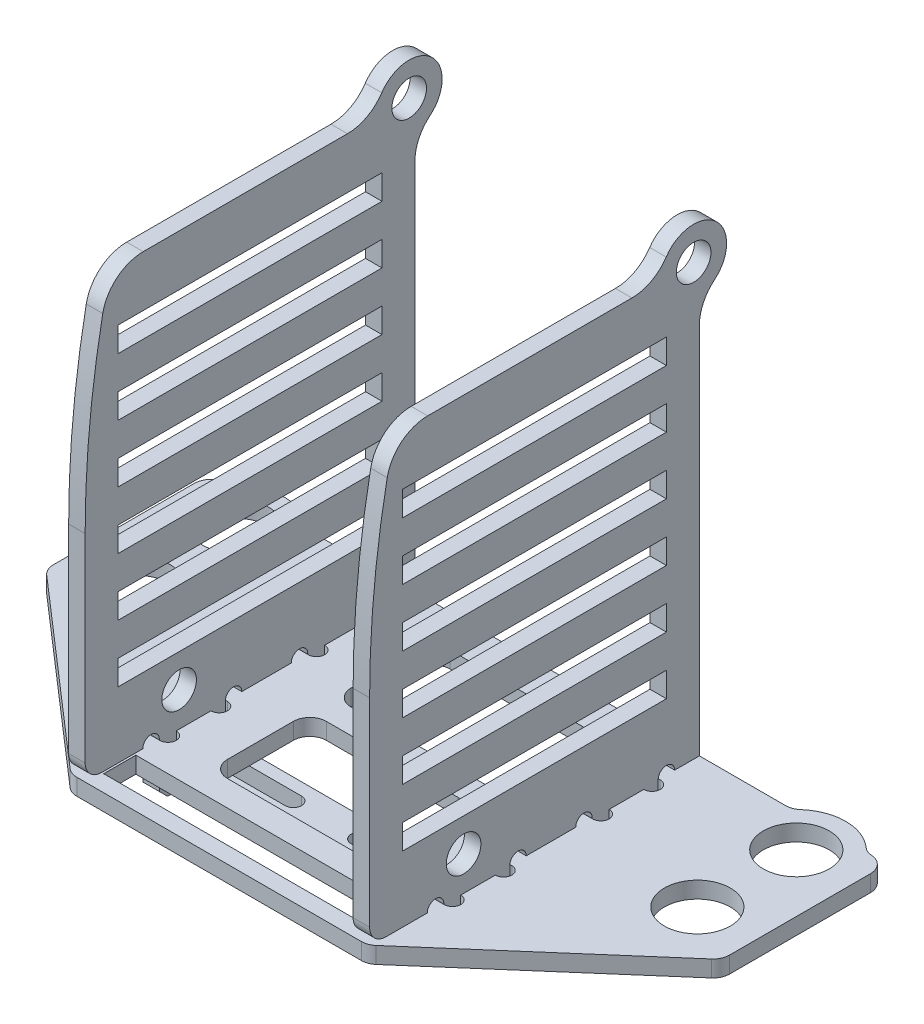
from build123d import *

# Parameters (mm, degrees)
SKETCH_1_R      = 4
SKETCH_1_W      = 20
SKETCH_1_H      = 12
SKETCH_1_W_2    = 32
SKETCH_1_H_2    = 3.9
EXTRUDE_1_DEPTH = 2
FILLET_1_R      = 2
FILLET_2_R      = 2
SKETCH_2_R      = 2.1
SKETCH_2_W      = 32
SKETCH_2_H      = 3
EXTRUDE_2_DEPTH = 1
FILLET_3_R      = 5
FILLET_4_R      = 2
CHAMFER_1_SIZE  = 1
EXTRUDE_3_DEPTH = 1


with BuildPart() as part:
    # 草图1 → 凸台-拉伸1 (new body)
    with BuildSketch(Plane(origin=(0, 0, 0), x_dir=(1, 0, 0), z_dir=(0, 1, 0))):
        with BuildLine():
            Line((-41, -10), (-41, 10))
            Line((-41, 10), (-38.472135955, 10))
            ThreePointArc((-38.472135955, 10), (-34, 12), (-29.527864045, 10))
            Line((-29.527864045, 10), (29.527864045, 10))
            ThreePointArc((29.527864045, 10), (34, 12), (38.472135955, 10))
            Line((38.472135955, 10), (41, 10))
            Line((41, 10), (41, -10))
            Line((41, -10), (18, -30))
            Line((18, -30), (-18, -30))
            Line((-18, -30), (-41, -10))
        make_face()
        with Locations(Location((-34, 6, 0), (0, 0, 270))):
            Circle(SKETCH_1_R, mode=Mode.SUBTRACT)
        with Locations(Location((-34, -6, 0), (0, 0, 90))):
            Circle(SKETCH_1_R, mode=Mode.SUBTRACT)
        with Locations(Location((34, -6, 0), (0, 0, 270))):
            Circle(SKETCH_1_R, mode=Mode.SUBTRACT)
        with Locations(Location((34, 6, 0), (0, 0, 90))):
            Circle(SKETCH_1_R, mode=Mode.SUBTRACT)
        with BuildLine():
            Line((-18.4, -12.9), (-16.1, -12.9))
            ThreePointArc((-16.1, -12.9), (-15.1, -13.9), (-16.1, -14.9))
            Line((-16.1, -14.9), (-16.1, -19.1))
            ThreePointArc((-16.1, -19.1), (-15.1, -20.1), (-16.1, -21.1))
            Line((-16.1, -21.1), (-18.4, -21.1))
            ThreePointArc((-18.4, -21.1), (-19.4, -20.1), (-18.4, -19.1))
            Line((-18.4, -19.1), (-18.4, -14.9))
            ThreePointArc((-18.4, -14.9), (-19.4, -13.9), (-18.4, -12.9))
        make_face(mode=Mode.SUBTRACT)
        with BuildLine():
            Line((-18.4, 5.1), (-16.1, 5.1))
            ThreePointArc((-16.1, 5.1), (-15.1, 4.1), (-16.1, 3.1))
            Line((-16.1, 3.1), (-16.1, -1.1))
            ThreePointArc((-16.1, -1.1), (-15.1, -2.1), (-16.1, -3.1))
            Line((-16.1, -3.1), (-18.4, -3.1))
            ThreePointArc((-18.4, -3.1), (-19.4, -2.1), (-18.4, -1.1))
            Line((-18.4, -1.1), (-18.4, 3.1))
            ThreePointArc((-18.4, 3.1), (-19.4, 4.1), (-18.4, 5.1))
        make_face(mode=Mode.SUBTRACT)
        with BuildLine():
            Line((18.4, -14.9), (18.4, -19.1))
            ThreePointArc((18.4, -19.1), (19.4, -20.1), (18.4, -21.1))
            Line((18.4, -21.1), (16.1, -21.1))
            ThreePointArc((16.1, -21.1), (15.1, -20.1), (16.1, -19.1))
            Line((16.1, -19.1), (16.1, -14.9))
            ThreePointArc((16.1, -14.9), (15.1, -13.9), (16.1, -12.9))
            Line((16.1, -12.9), (18.4, -12.9))
            ThreePointArc((18.4, -12.9), (19.4, -13.9), (18.4, -14.9))
        make_face(mode=Mode.SUBTRACT)
        with BuildLine():
            Line((18.4, 3.1), (18.4, -1.1))
            ThreePointArc((18.4, -1.1), (19.4, -2.1), (18.4, -3.1))
            Line((18.4, -3.1), (16.1, -3.1))
            ThreePointArc((16.1, -3.1), (15.1, -2.1), (16.1, -1.1))
            Line((16.1, -1.1), (16.1, 3.1))
            ThreePointArc((16.1, 3.1), (15.1, 4.1), (16.1, 5.1))
            Line((16.1, 5.1), (18.4, 5.1))
            ThreePointArc((18.4, 5.1), (19.4, 4.1), (18.4, 3.1))
        make_face(mode=Mode.SUBTRACT)
        with Locations((0, -15)):
            Rectangle(SKETCH_1_W, SKETCH_1_H, mode=Mode.SUBTRACT)
        with Locations((0, -26.05)):
            Rectangle(SKETCH_1_W_2, SKETCH_1_H_2, mode=Mode.SUBTRACT)
        Rectangle(SKETCH_1_W, SKETCH_1_H, mode=Mode.SUBTRACT)
    extrude(amount=EXTRUDE_1_DEPTH)

    # 圆角1
    fillet_1_edges = [part.edges().sort_by_distance(p)[0] for p in [
        (10, 1, 6),
        (10, 1, -6),
        (-10, 1, -6),
        (-10, 1, 6),
        (-41, 1, 10),
        (-10, 1, 21),
        (-41, 1, -10),
        (10, 1, 21),
        (10, 1, 9),
        (-10, 1, 9),
        (41, 1, -10),
        (41, 1, 10),
        (18, 1, 30),
        (-18, 1, 30),
    ]]
    fillet(fillet_1_edges, radius=FILLET_1_R)

    # 圆角2
    fillet_2_edges = [part.edges().sort_by_distance(p)[0] for p in [
        (38.472135955, 1, -10),
        (29.527864045, 1, -10),
        (-29.527864045, 1, -10),
        (-38.472135955, 1, -10),
    ]]
    fillet(fillet_2_edges, radius=FILLET_2_R)


with BuildPart() as body_2:
    # 草图2 → 凸台-拉伸2 (new, symmetric)
    with BuildSketch(Plane(origin=(-17.25, 0, 0), x_dir=(0, 0, -1), z_dir=(1, 0, 0))):
        with BuildLine():
            Line((-3, 0), (5, 0))
            Line((5, 0), (5, 2))
            ThreePointArc((5, 2), (6, 3), (7, 2))
            Line((7, 2), (10, 2))
            Line((10, 2), (10, 50.251726266))
            ThreePointArc((10, 50.251726266), (11.869046516, 57.255941943), (5.3, 54.19))
            Line((5.3, 54.19), (-27, 54.19))
            ThreePointArc((-27, 54.19), (-29.247538084, 41.228440381), (-30, 28.095))
            Line((-30, 28.095), (-30, 2))
            Line((-30, 2), (-23, 2))
            ThreePointArc((-23, 2), (-22, 3), (-21, 2))
            Line((-21, 2), (-21, -4.5))
            Line((-21, -4.5), (-13, -4.5))
            Line((-13, -4.5), (-13, 2))
            ThreePointArc((-13, 2), (-12, 3), (-11, 2))
            Line((-11, 2), (-5, 2))
            ThreePointArc((-5, 2), (-4, 3), (-3, 2))
            Line((-3, 2), (-3, 0))
        make_face()
        with BuildLine():
            ThreePointArc((-16.229070676, -0.2), (-15.314535338, 0.395493985), (-14.4, -0.2))
            ThreePointArc((-14.4, -0.2), (-14.336134771, -0.397788016), (-14.314535338, -0.604506015))
            ThreePointArc((-14.314535338, -0.604506015), (-14.336134771, -0.811224014), (-14.4, -1.00901203))
            Line((-14.4, -1.00901203), (-14.4, -1.69098797))
            ThreePointArc((-14.4, -1.69098797), (-14.336134771, -1.888775986), (-14.314535338, -2.095493985))
            ThreePointArc((-14.314535338, -2.095493985), (-14.336134771, -2.302211984), (-14.4, -2.5))
            ThreePointArc((-14.4, -2.5), (-15.314535338, -3.095493985), (-16.229070676, -2.5))
            Line((-16.229070676, -2.5), (-17.770929324, -2.5))
            ThreePointArc((-17.770929324, -2.5), (-18.685464662, -3.095493985), (-19.6, -2.5))
            ThreePointArc((-19.6, -2.5), (-19.685464662, -2.095493985), (-19.6, -1.69098797))
            Line((-19.6, -1.69098797), (-19.6, -1.00901203))
            ThreePointArc((-19.6, -1.00901203), (-19.685464662, -0.604506015), (-19.6, -0.2))
            ThreePointArc((-19.6, -0.2), (-18.685464662, 0.395493985), (-17.770929324, -0.2))
            Line((-17.770929324, -0.2), (-16.229070676, -0.2))
        make_face(mode=Mode.SUBTRACT)
        with Locations((-18.6, 6)):
            Circle(SKETCH_2_R, mode=Mode.SUBTRACT)
        with Locations((-10, 11.5)):
            Rectangle(SKETCH_2_W, SKETCH_2_H, mode=Mode.SUBTRACT)
        with Locations((-10, 18.5)):
            Rectangle(SKETCH_2_W, SKETCH_2_H, mode=Mode.SUBTRACT)
        with Locations((-10, 25.5)):
            Rectangle(SKETCH_2_W, SKETCH_2_H, mode=Mode.SUBTRACT)
        with Locations((-10, 32.5)):
            Rectangle(SKETCH_2_W, SKETCH_2_H, mode=Mode.SUBTRACT)
        with Locations((-10, 39.5)):
            Rectangle(SKETCH_2_W, SKETCH_2_H, mode=Mode.SUBTRACT)
        with Locations((-10, 46.5)):
            Rectangle(SKETCH_2_W, SKETCH_2_H, mode=Mode.SUBTRACT)
        with Locations((9.3, 54.19)):
            Circle(SKETCH_2_R, mode=Mode.SUBTRACT)
    extrude(amount=EXTRUDE_2_DEPTH, both=True)

    # 圆角3
    fillet_3_edges = [body_2.edges().sort_by_distance(p)[0] for p in [
        (-17.25, 54.19, -5.3),
        (-17.25, 50.251726266, -10),
        (-17.25, 54.19, 27),
    ]]
    fillet(fillet_3_edges, radius=FILLET_3_R)

    # 圆角4
    fillet_4_edges = [body_2.edges().sort_by_distance(p)[0] for p in [
        (-17.25, 2, 30),
    ]]
    fillet(fillet_4_edges, radius=FILLET_4_R)

    # 倒角1
    chamfer_1_edges = [body_2.edges().sort_by_distance(p)[0] for p in [
        (-17.25, -4.5, 13),
        (-17.25, -4.5, 21),
    ]]
    chamfer(chamfer_1_edges, length=CHAMFER_1_SIZE)


with BuildPart() as body_3:
    # 镜向1: mirrored copy
    add(body_2.part.mirror(Plane(origin=(0, 0, 0), x_dir=(0, 0, 1), z_dir=(1, 0, 0))))


with BuildPart() as body_4:
    # 草图3 → 凸台-拉伸3 (new, symmetric)
    with BuildSketch(Plane(origin=(0, -1.35, 0), x_dir=(-1, 0, 0), z_dir=(0, -1, 0))):
        Polygon((20.25, -18.5), (20.25, -15.5), (18.25, -14.5), (-18.25, -14.5), (-20.25, -15.5), (-20.25, -18.5), (-18.25, -19.5), (18.25, -19.5), align=None)
        with BuildLine():
            Line((14, -18), (4, -18))
            ThreePointArc((4, -18), (3, -17), (4, -16))
            Line((4, -16), (14, -16))
            ThreePointArc((14, -16), (15, -17), (14, -18))
        make_face(mode=Mode.SUBTRACT)
        with BuildLine():
            Line((-14, -18), (-4, -18))
            ThreePointArc((-4, -18), (-3, -17), (-4, -16))
            Line((-4, -16), (-14, -16))
            ThreePointArc((-14, -16), (-15, -17), (-14, -18))
        make_face(mode=Mode.SUBTRACT)
    extrude(amount=EXTRUDE_3_DEPTH, both=True)


solid = Compound([part.part, body_2.part, body_3.part, body_4.part])
